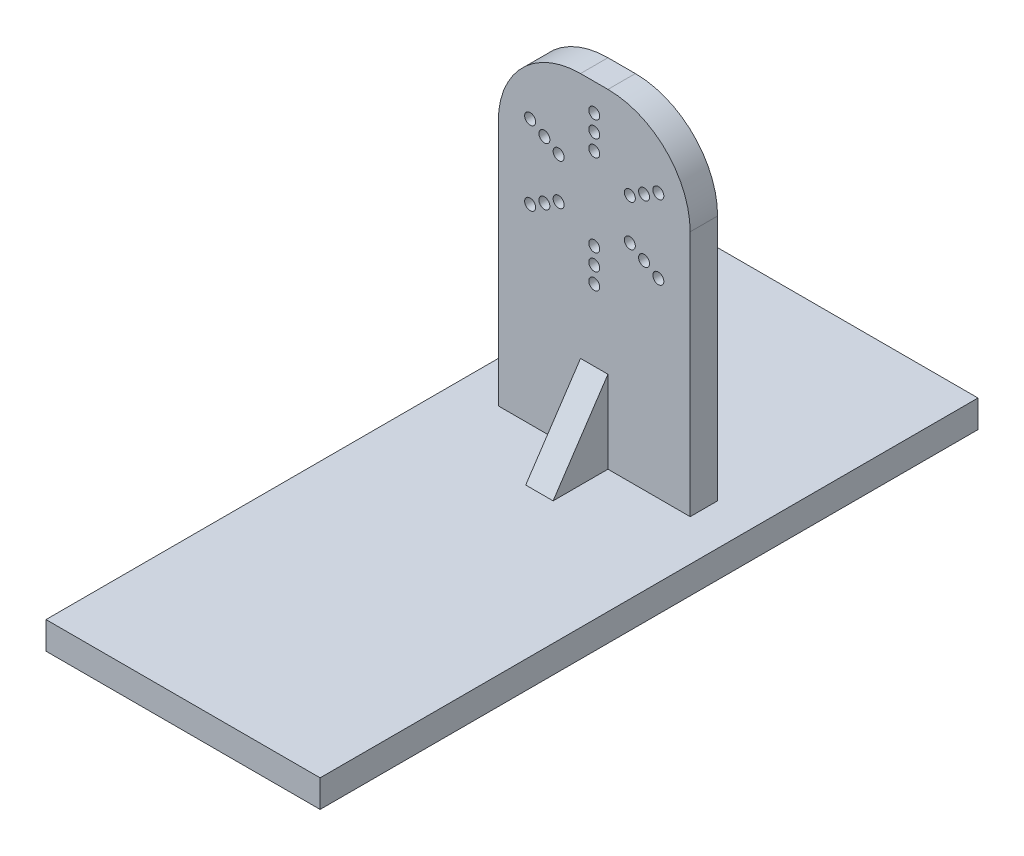
from build123d import *

# Parameters (mm, degrees)
SKETCH1_W           = 35
SKETCH1_H           = 60
BOSS_EXTRUDE1_DEPTH = 2.5
SKETCH2_R           = 1
CUT_EXTRUDE1_DEPTH  = 5
FILLET1_R           = 15
SKETCH3_W           = 50
SKETCH3_H           = 5
BOSS_EXTRUDE2_DEPTH = 80
BOSS_EXTRUDE3_DEPTH = 2.5
SKETCH5_W           = 50
SKETCH5_H           = 5
BOSS_EXTRUDE4_DEPTH = 40
BOSS_EXTRUDE5_DEPTH = 1.5


with BuildPart() as part:
    # Sketch1 → Boss-Extrude1 (new, symmetric)
    with BuildSketch(Plane.XY):
        Rectangle(SKETCH1_W, SKETCH1_H)
    extrude(amount=BOSS_EXTRUDE1_DEPTH, both=True)

    # Sketch2 → Cut-Extrude1 (cut)
    with BuildSketch(Plane(origin=(0, 0, -2.5), x_dir=(-1, 0, 0), z_dir=(0, 0, -1))):
        with Locations((0, 25)):
            Circle(SKETCH2_R)
        with Locations((0, 22)):
            Circle(SKETCH2_R)
        with Locations((0, 19)):
            Circle(SKETCH2_R)
        with Locations((11.691342951, 18.25)):
            Circle(SKETCH2_R)
        with Locations((9.09326674, 16.75)):
            Circle(SKETCH2_R)
        with Locations((6.495190528, 15.25)):
            Circle(SKETCH2_R)
        with Locations((11.691342951, 4.75)):
            Circle(SKETCH2_R)
        with Locations((9.09326674, 6.25)):
            Circle(SKETCH2_R)
        with Locations((6.495190528, 7.75)):
            Circle(SKETCH2_R)
        with Locations((0, -2)):
            Circle(SKETCH2_R)
        with Locations((0, 1)):
            Circle(SKETCH2_R)
        with Locations((0, 4)):
            Circle(SKETCH2_R)
        with Locations((-11.691342951, 4.75)):
            Circle(SKETCH2_R)
        with Locations((-9.09326674, 6.25)):
            Circle(SKETCH2_R)
        with Locations((-6.495190528, 7.75)):
            Circle(SKETCH2_R)
        with Locations((-11.691342951, 18.25)):
            Circle(SKETCH2_R)
        with Locations((-9.09326674, 16.75)):
            Circle(SKETCH2_R)
        with Locations((-6.495190528, 15.25)):
            Circle(SKETCH2_R)
    extrude(amount=-CUT_EXTRUDE1_DEPTH, mode=Mode.SUBTRACT)

    # Fillet1
    fillet1_edges = [part.edges().sort_by_distance(p)[0] for p in [
        (-17.5, 30, 0),
        (17.5, 30, 0),
    ]]
    fillet(fillet1_edges, radius=FILLET1_R)

    # Sketch3 → Boss-Extrude2 (add)
    with BuildSketch(Plane(origin=(0, 0, -2.5), x_dir=(-1, 0, 0), z_dir=(0, 0, -1))):
        with Locations((0, -32.5)):
            Rectangle(SKETCH3_W, SKETCH3_H)
    extrude(amount=-BOSS_EXTRUDE2_DEPTH)

    # Sketch4 → Boss-Extrude3 (add, symmetric)
    with BuildSketch(Plane(origin=(0, 0, 0), x_dir=(0, 0, -1), z_dir=(1, 0, 0))):
        Polygon((-12.5, -30), (-2.5, -30), (-2.5, -15), align=None)
    extrude(amount=BOSS_EXTRUDE3_DEPTH, both=True)

    # Sketch5 → Boss-Extrude4 (add)
    with BuildSketch(Plane(origin=(0, 0, -2.5), x_dir=(-1, 0, 0), z_dir=(0, 0, -1))):
        with Locations((0, -32.5)):
            Rectangle(SKETCH5_W, SKETCH5_H)
    extrude(amount=BOSS_EXTRUDE4_DEPTH)

    # Sketch6 → Boss-Extrude5 (add, symmetric)
    with BuildSketch(Plane(origin=(0, 0, 0), x_dir=(0, 0, -1), z_dir=(1, 0, 0))):
        Polygon((2.5, -30), (8.5, -30), (2.5, -20), align=None)
    extrude(amount=BOSS_EXTRUDE5_DEPTH, both=True)


solid = part.part
